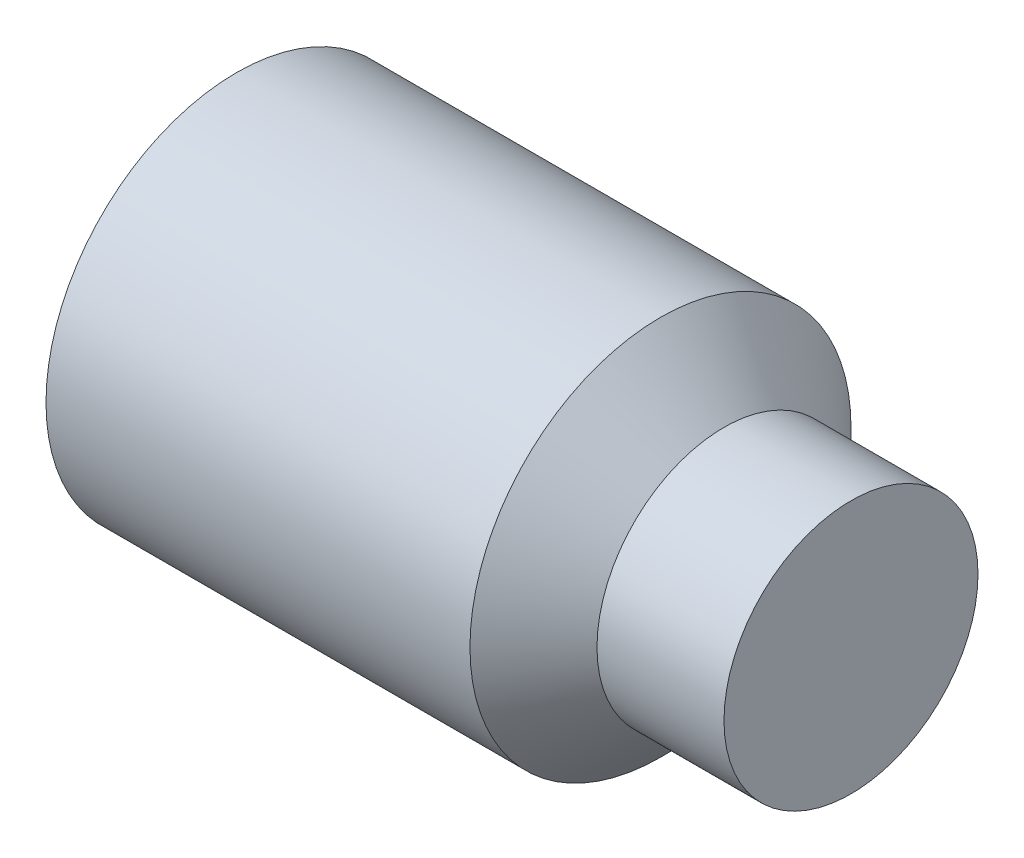
from build123d import *

# Parameters (mm, degrees)
HEX_2_DEPTH = 1.2


with BuildPart() as part:
    # BodySke → BaseBody (revolve)
    with BuildSketch(Plane.XY, mode=Mode.PRIVATE) as basebody_sk:
        Polygon((0, 0), (0, 1.2195), (0.161946751, 1.5), (3.5, 1.5), (4, 1), (5, 1), (5, 0), align=None)
    revolve(basebody_sk.sketch.rotate(Axis((-12.7, 0, 0), (1, 0, 0)), 90), axis=Axis((-12.7, 0, 0), (1, 0, 0)))

    # Sketch2 → Hex 2 (cut)
    with BuildSketch(Plane.ZY):
        Polygon((0.433012702, 0.75), (-0.433012702, 0.75), (-0.866025404, 0), (-0.433012702, -0.75), (0.433012702, -0.75), (0.866025404, 0), align=None)
    extrude(amount=-HEX_2_DEPTH, mode=Mode.SUBTRACT)


solid = part.part
